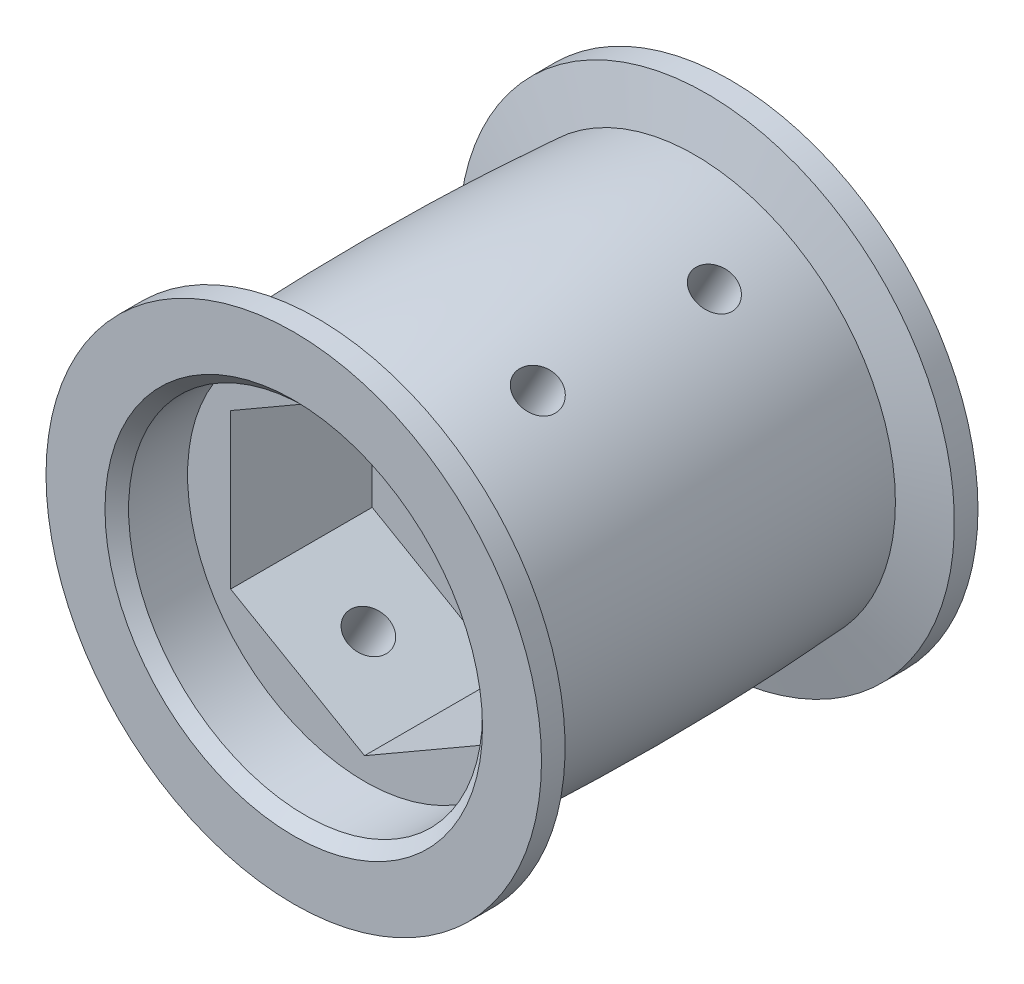
from build123d import *

# Parameters (mm, degrees)
ESQUISSE1_R                   = 21
ESQUISSE1_R_2                 = 3.25
BOSS_EXTRU_1_DEPTH            = 31
ESQUISSE2_R                   = 21
ESQUISSE2_R_2                 = 15
BOSS_EXTRU_2_DEPTH            = 6
ENL_V_MAT_EXTRU_9_DEPTH       = 12
CHANFREIN1_SIZE               = 1
ESQUISSE11_R                  = 1.25
ENL_V_MAT_EXTRU_10_DEPTH      = 48.444704657
ESQUISSE12_R                  = 4.25
ENL_V_MAT_EXTRU_11_DEPTH      = 4
ENL_V_MAT_EXTRU_12_DEPTH      = 56.054580282
ENL_V_MAT_EXTRU_12_DEPTH_BACK = 56.054580282
ESQUISSE13_R                  = 1.75


with BuildPart() as part:
    # Esquisse1 → Boss.-Extru.1 (new body)
    with BuildSketch(Plane.XY):
        Circle(ESQUISSE1_R)
        Circle(ESQUISSE1_R_2, mode=Mode.SUBTRACT)
    extrude(amount=BOSS_EXTRU_1_DEPTH)

    # Esquisse2 → Boss.-Extru.2 (add)
    with BuildSketch(Plane.XY.offset(31)):
        Circle(ESQUISSE2_R)
        Circle(ESQUISSE2_R_2, mode=Mode.SUBTRACT)
    extrude(amount=BOSS_EXTRU_2_DEPTH)

    # Esquisse9 → Enlèv. mat.-Extru.9 (cut)
    with BuildSketch(Plane.XY.offset(31)):
        Polygon((11.35, -6.552925555), (11.35, 6.552925555), (0, 13.105851111), (-11.35, 6.552925555), (-11.35, -6.552925555), (0, -13.105851111), align=None)
    extrude(amount=-ENL_V_MAT_EXTRU_9_DEPTH, mode=Mode.SUBTRACT)

    # Chanfrein1
    chanfrein1_edges = [part.edges().sort_by_distance(p)[0] for p in [
        (-15, 0, 37),
    ]]
    chamfer(chanfrein1_edges, length=CHANFREIN1_SIZE)

    # Esquisse10 → Enlèvement de matière-Révolution1 (revolve, cut)
    with BuildSketch(Plane(origin=(0, 0, 0), x_dir=(0, 0, -1), z_dir=(1, 0, 0)), mode=Mode.PRIVATE) as enl_vement_de_mati_re_r_volution1_sk:
        with BuildLine():
            Line((-35, 21), (-2, 21))
            Line((-2, 21), (-3, 17))
            ThreePointArc((-3, 17), (-18.5, 17.5), (-34, 17))
            Line((-34, 17), (-35, 21))
        make_face()
    revolve(enl_vement_de_mati_re_r_volution1_sk.sketch.rotate(Axis((0, 0, 0), (0, 0, 1)), 90), axis=Axis((0, 0, 0), (0, 0, 1)), mode=Mode.SUBTRACT)

    # Esquisse11 → Enlèv. mat.-Extru.10 (cut, through all)
    with BuildSketch(Plane(origin=(0, 0, 0), x_dir=(-1, 0, 0), z_dir=(0, 0, -1))):
        with Locations((-6.92820323, 4)):
            Circle(ESQUISSE11_R)
        with Locations((6.92820323, 4)):
            Circle(ESQUISSE11_R)
        with Locations((0, -8)):
            Circle(ESQUISSE11_R)
    extrude(amount=-ENL_V_MAT_EXTRU_10_DEPTH, mode=Mode.SUBTRACT)

    # Esquisse12 → Enlèv. mat.-Extru.11 (cut)
    with BuildSketch(Plane(origin=(0, 0, 0), x_dir=(-1, 0, 0), z_dir=(0, 0, -1))):
        with Locations((-6.92820323, 4)):
            Circle(ESQUISSE12_R)
        with Locations((6.92820323, 4)):
            Circle(ESQUISSE12_R)
        with Locations((0, -8)):
            Circle(ESQUISSE12_R)
    extrude(amount=-ENL_V_MAT_EXTRU_11_DEPTH, mode=Mode.SUBTRACT)

    # Esquisse13 → Enlèv. mat.-Extru.12 (cut, two sides: drawn at the far end of the back side and taken through both)
    with BuildSketch(Plane(origin=(-5.675, -9.829388333, 0), x_dir=(0.8660254037844387, -0.49999999999999983, 0), z_dir=(0.49999999999999983, 0.8660254037844387, 0)).offset(-ENL_V_MAT_EXTRU_12_DEPTH_BACK)):
        with Locations(Location((0, -25, 0), (0, 0, 180))):
            Circle(ESQUISSE13_R)
        with Locations(Location((0, -10, 0), (0, 0, 180))):
            Circle(ESQUISSE13_R)
    extrude(amount=ENL_V_MAT_EXTRU_12_DEPTH + ENL_V_MAT_EXTRU_12_DEPTH_BACK, mode=Mode.SUBTRACT)


solid = part.part
